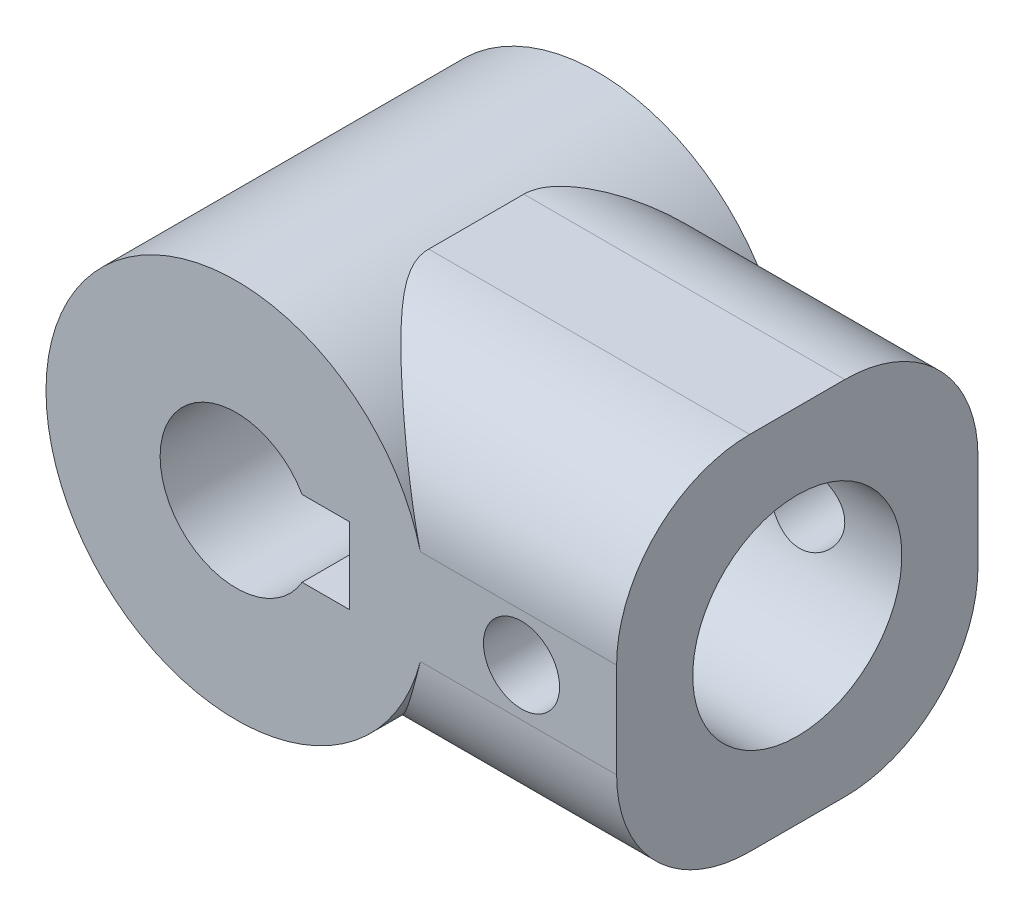
from build123d import *

# Parameters (mm, degrees)
ESBO_O1_R                = 4
ESBO_O1_R_2              = 2
RESSALTO_EXTRUS_O1_DEPTH = 19
FILETE1_R                = 7
ESBO_O3_R                = 5.497341607
CORTE_EXTRUS_O1_DEPTH    = 12.5
CORTE_EXTRUS_O5_DEPTH    = 33.95451427


with BuildPart() as part:
    # Esboço1 → Ressalto-extrusão1 (new body)
    with BuildSketch(Plane.XY):
        with BuildLine():
            Line((5, -9.5), (5, 0))
            Line((5, 0), (5, 9.5))
            Line((5, 9.5), (-11.877501001, 9.5))
            ThreePointArc((-11.877501001, 9.5), (-25, 0), (-11.877501001, -9.5))
            Line((-11.877501001, -9.5), (5, -9.5))
        make_face()
        with Locations((-15, 0)):
            Circle(ESBO_O1_R, mode=Mode.SUBTRACT)
        Circle(ESBO_O1_R_2, mode=Mode.SUBTRACT)
    extrude(amount=RESSALTO_EXTRUS_O1_DEPTH)

    # Filete1
    filete1_edges = [part.edges().sort_by_distance(p)[0] for p in [
        (-3.4387505, 9.5, 0),
        (-3.4387505, 9.5, 19),
        (-3.4387505, -9.5, 19),
        (-3.4387505, -9.5, 0),
    ]]
    fillet(filete1_edges, radius=FILETE1_R)

    # Esboço3 → Corte-extrusão1 (cut)
    with BuildSketch(Plane(origin=(5, 0, 0), x_dir=(0, 0, -1), z_dir=(1, 0, 0))):
        with Locations(Location((-9.5, 0, 0), (0, 0, 90))):
            Circle(ESBO_O3_R)
    extrude(amount=-CORTE_EXTRUS_O1_DEPTH, mode=Mode.SUBTRACT)

    # Esboço5 → Corte-extrusão5 (cut, through all)
    with BuildSketch(Plane(origin=(0, 0, 0), x_dir=(-1, 0, 0), z_dir=(0, 0, -1))):
        with BuildLine():
            Line((9.035898385, 0), (9.035898385, -2))
            Line((9.035898385, -2), (11.535898385, -2))
            ThreePointArc((11.535898385, -2), (11, 0), (11.535898385, 2))
            Line((11.535898385, 2), (9.035898385, 2))
            Line((9.035898385, 2), (9.035898385, 0))
        make_face()
    extrude(amount=-CORTE_EXTRUS_O5_DEPTH, mode=Mode.SUBTRACT)


solid = part.part
